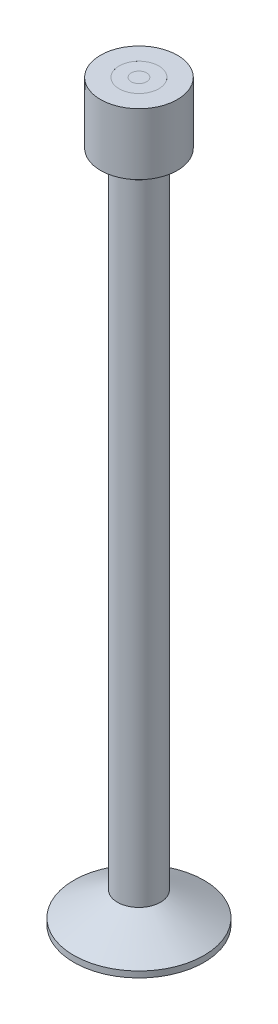
from build123d import *

# Parameters (mm, degrees)
CROQUIS4_R              = 1.375
SALIENTE_EXTRUIR1_DEPTH = 0.1


with BuildPart() as part:
    # Croquis1 → Revolución1 (revolve)
    with BuildSketch(Plane.XY, mode=Mode.PRIVATE) as revoluci_n1_sk:
        Polygon((5.375, 0), (5.375, 0.5), (1.78, 2.5), (1.78, 54.5), (3.171785891, 55.5), (3.171785891, 60.571), (1.635, 60.571), (1.375, 54.942193309), (1.375, 0), align=None)
        Polygon((0.375, 0.1), (0.375, 54.942193309), (0.635, 60.571), (0.442390715, 60.571), (0, 60.571), (0, 0.1), align=None)
    revolve(revoluci_n1_sk.sketch.rotate(Axis((0, 60.571, 0), (0, -1, 0)), 180), axis=Axis((0, 60.571, 0), (0, -1, 0)))


with BuildPart() as body_2:
    # Croquis3 → Revolución2 (revolve)
    with BuildSketch(Plane.XY, mode=Mode.PRIVATE) as revoluci_n2_sk:
        Polygon((0.375, 54.942193309), (0.635, 60.571), (1.635, 60.571), (1.375, 54.942193309), (1.375, 0.1), (0.375, 0.1), align=None)
    revolve(revoluci_n2_sk.sketch.rotate(Axis((0, 55.5, 0), (0, -1, 0)), 90), axis=Axis((0, 55.5, 0), (0, -1, 0)))


with BuildPart() as body_3:
    # Croquis4 → Saliente-Extruir1 (new body)
    with BuildSketch(Plane.XZ):
        Circle(CROQUIS4_R)
    extrude(amount=-SALIENTE_EXTRUIR1_DEPTH)


solid = Compound([part.part, body_2.part, body_3.part])
